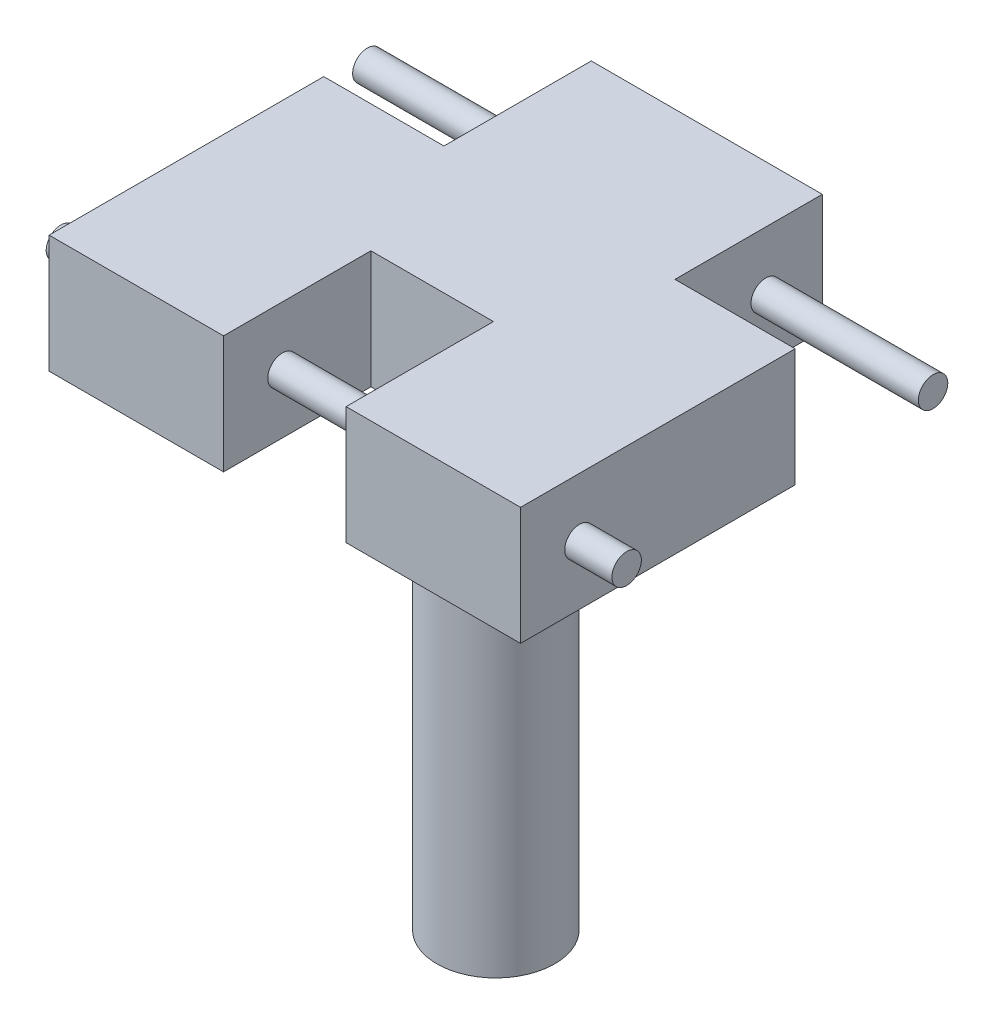
from build123d import *

# Parameters (mm, degrees)
FINGERBASE_DEPTH         = 6.35
BOSS_EXTRUDE1_DEPTH      = 2.54
BOSS_EXTRUDE1_DEPTH_BACK = 27.94
SKETCH2_R                = 0.79375
SKETCH3_R                = 3.175
BOSS_EXTRUDE2_DEPTH      = 25.4


with BuildPart() as part:
    # Sketch1 → FingerBase (new body)
    with BuildSketch(Plane(origin=(0, 0, 0), x_dir=(1, 0, 0), z_dir=(0, 1, 0))):
        Polygon((-6.223, 6.223), (6.223, 6.223), (6.223, -1.7145), (12.7, -1.7145), (12.7, -16.51), (3.302, -16.51), (3.302, -8.5725), (-3.302, -8.5725), (-3.302, -16.51), (-12.7, -16.51), (-12.7, -1.7145), (-6.223, -1.7145), align=None)
    extrude(amount=FINGERBASE_DEPTH)

    # Sketch2 → Boss-Extrude1 (add, two sides: drawn at the far end of the back side and taken through both)
    with BuildSketch(Plane(origin=(12.7, 0, 0), x_dir=(0, 0, -1), z_dir=(1, 0, 0)).offset(-BOSS_EXTRUDE1_DEPTH_BACK)):
        with Locations((-13.335, 3.175)):
            Circle(SKETCH2_R)
        with Locations((3.175, 3.175)):
            Circle(SKETCH2_R)
    extrude(amount=BOSS_EXTRUDE1_DEPTH + BOSS_EXTRUDE1_DEPTH_BACK)

    # Sketch3 → Boss-Extrude2 (add)
    with BuildSketch(Plane.XZ):
        with Locations(Location((0, 5.1435, 0), (0, 0, 270))):
            Circle(SKETCH3_R)
    extrude(amount=BOSS_EXTRUDE2_DEPTH)


solid = part.part
